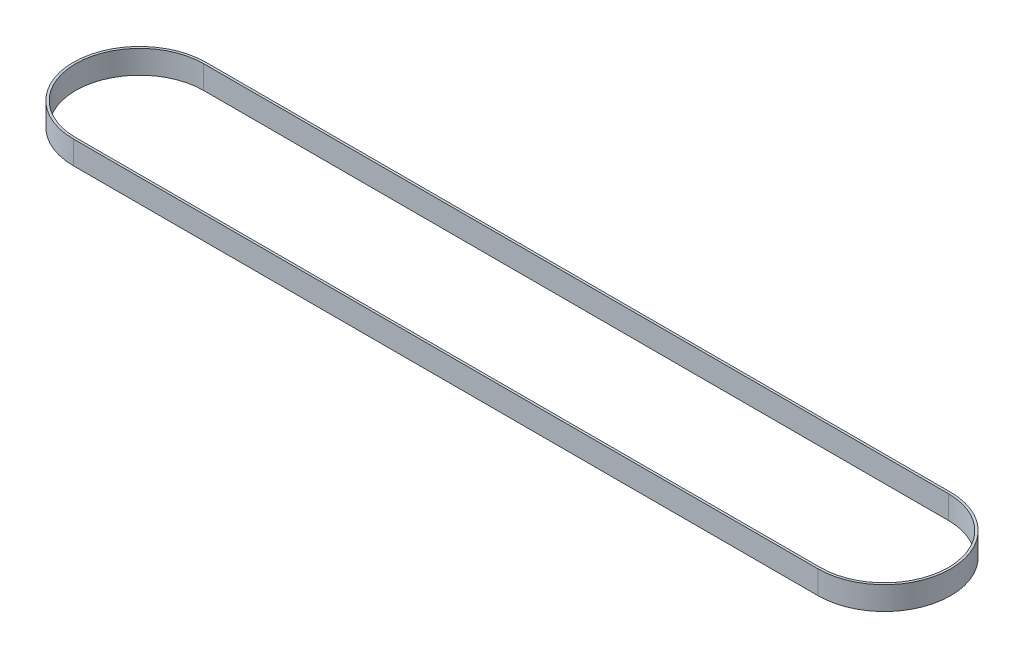
from build123d import *

# Parameters (mm, degrees)
EXTRUDE_1_DEPTH = 10


with BuildPart() as part:
    # 草图1 → 凸台-拉伸1 (new body)
    with BuildSketch(Plane(origin=(0, 0, 0), x_dir=(1, 0, 0), z_dir=(0, 1, 0))):
        with BuildLine():
            Line((0, 28.5), (320, 28.5))
            ThreePointArc((320, 28.5), (348.5, 0), (320, -28.5))
            Line((320, -28.5), (0, -28.5))
            ThreePointArc((0, -28.5), (-28.5, 0), (0, 28.5))
        make_face()
        with BuildLine():
            Line((0, 27.5), (320, 27.5))
            ThreePointArc((320, 27.5), (347.5, 0), (320, -27.5))
            Line((320, -27.5), (0, -27.5))
            ThreePointArc((0, -27.5), (-27.5, 0), (0, 27.5))
        make_face(mode=Mode.SUBTRACT)
    extrude(amount=EXTRUDE_1_DEPTH)


solid = part.part
